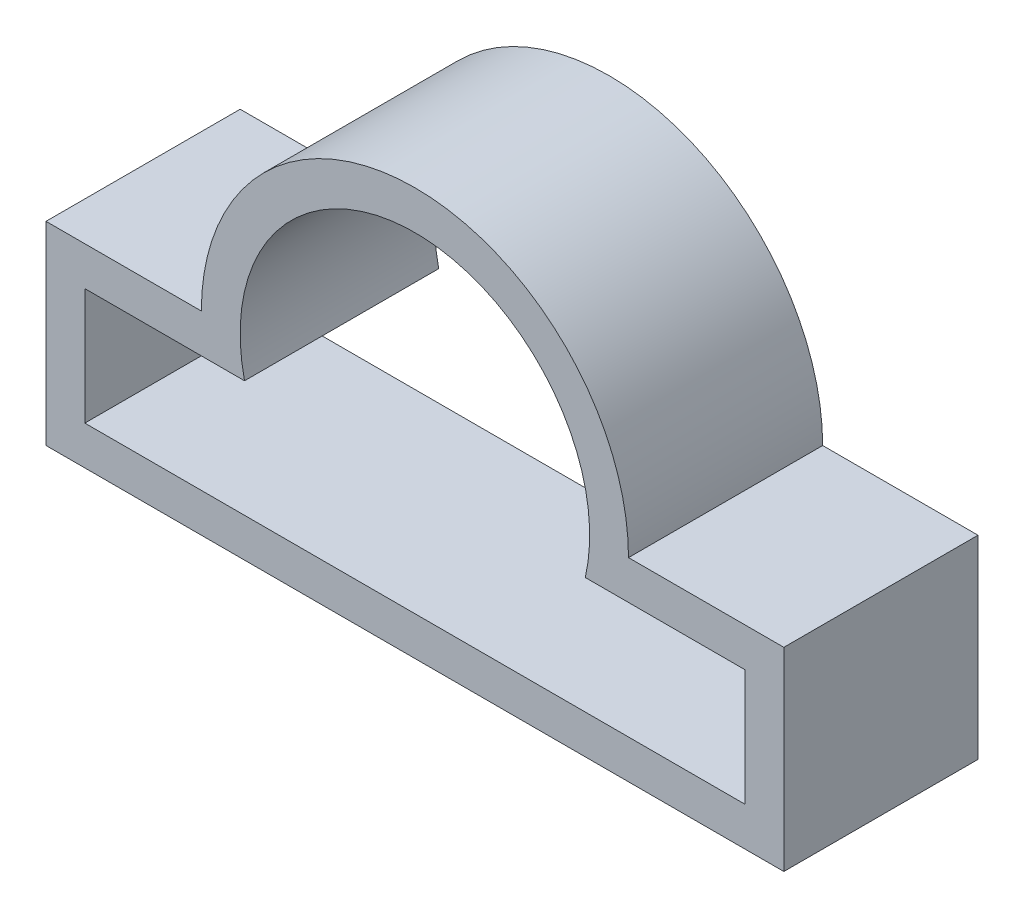
from build123d import *

# Parameters (mm, degrees)
EXTRUDE_THIN1_DEPTH = 10


with BuildPart() as part:
    # Sketch1 → Extrude-Thin1 (new body)
    with BuildSketch(Plane.XY):
        with BuildLine():
            Line((11, 10), (19, 10))
            Line((19, 10), (19, 0))
            Line((19, 0), (-19, 0))
            Line((-19, 0), (-19, 10))
            Line((-19, 10), (-11, 10))
            ThreePointArc((-11, 10), (0, 21), (11, 10))
        make_face()
        with BuildLine():
            Line((8.774964387, 8), (17, 8))
            Line((17, 8), (17, 2))
            Line((17, 2), (-17, 2))
            Line((-17, 2), (-17, 8))
            Line((-17, 8), (-8.774964387, 8))
            ThreePointArc((-8.774964387, 8), (0, 19), (8.774964387, 8))
        make_face(mode=Mode.SUBTRACT)
    extrude(amount=EXTRUDE_THIN1_DEPTH)


solid = part.part
